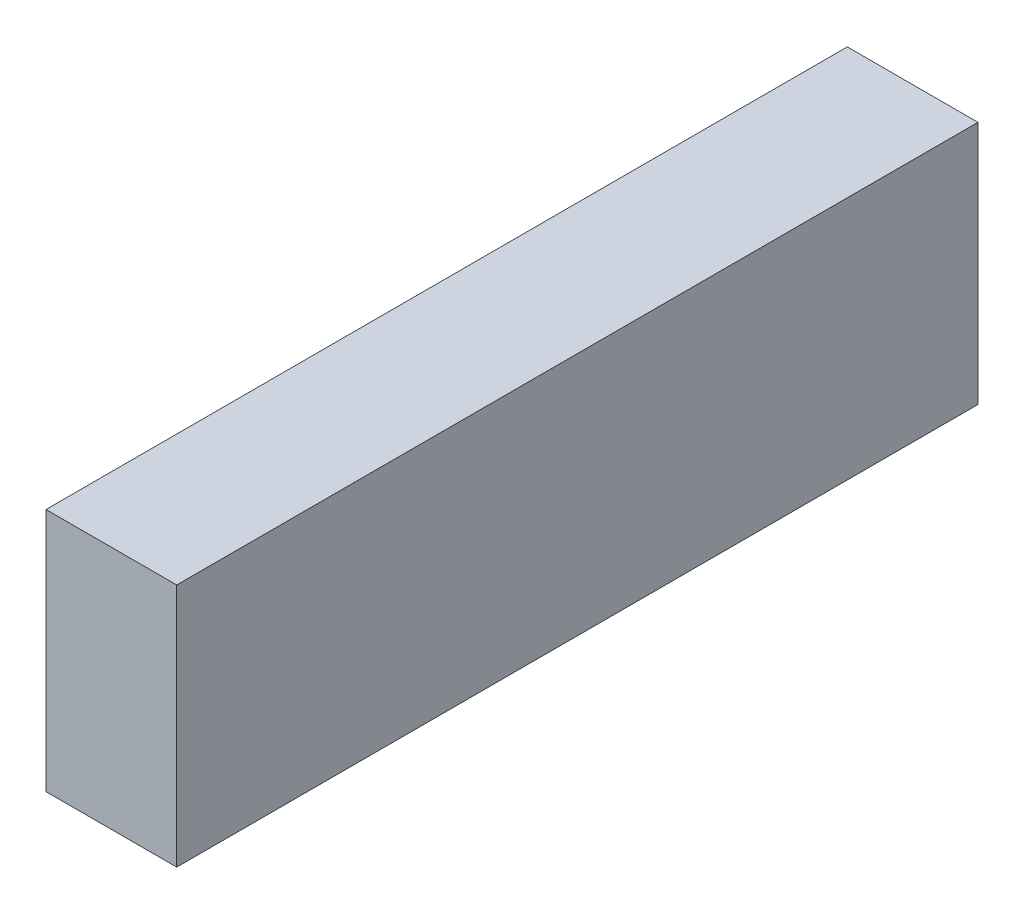
from build123d import *

# Parameters (mm, degrees)
SCHIZZO1_W                   = 23
SCHIZZO1_H                   = 43
ESTRUSIONE_ESTRUSIONE1_DEPTH = 141


with BuildPart() as part:
    # Schizzo1 → Estrusione-Estrusione1 (new body)
    with BuildSketch(Plane.XY):
        Rectangle(SCHIZZO1_W, SCHIZZO1_H)
    extrude(amount=ESTRUSIONE_ESTRUSIONE1_DEPTH)


solid = part.part
